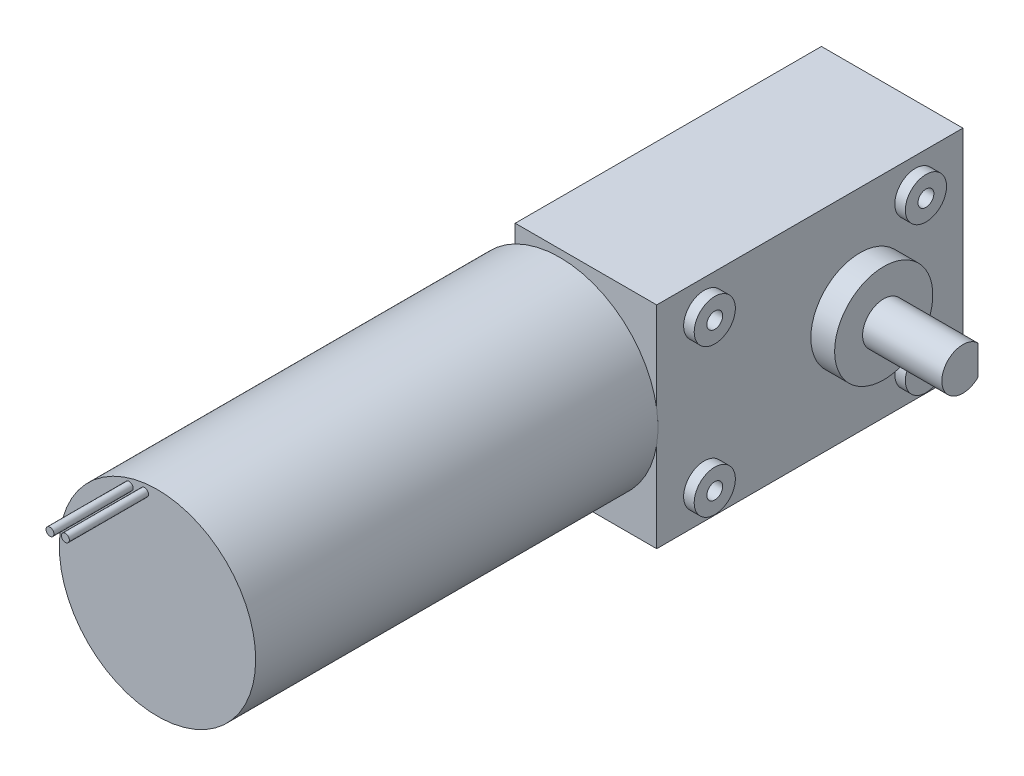
from build123d import *

# Parameters (mm, degrees)
SKETCH4_R            = 18.6
BOSS_EXTRUDE3_DEPTH  = 76.2
SKETCH5_R            = 0.75
BOSS_EXTRUDE4_DEPTH  = 15
SKETCH6_R            = 0.75
BOSS_EXTRUDE5_DEPTH  = 15
SKETCH7_W            = 26.8
SKETCH7_H            = 40
BOSS_EXTRUDE6_DEPTH  = 58
BOSS_EXTRUDE10_DEPTH = 1.8
BOSS_EXTRUDE11_DEPTH = 4.5
CUT_EXTRUDE1_START   = -3.5
CUT_EXTRUDE1_DEPTH   = 5.3
BOSS_EXTRUDE12_START = -28.8
BOSS_EXTRUDE12_DEPTH = 2
CUT_EXTRUDE2_START   = -28.8
CUT_EXTRUDE2_DEPTH   = 5.3
BOSS_EXTRUDE13_START = -31.3
BOSS_EXTRUDE13_DEPTH = 4.5
BOSS_EXTRUDE14_DEPTH = 15


with BuildPart() as part:
    # Sketch4 → Boss-Extrude3 (new body)
    with BuildSketch(Plane.XY):
        with Locations(Location((-63.856856352, 21.865677116, 0), (0, 0, 180))):
            Circle(SKETCH4_R)
    extrude(amount=BOSS_EXTRUDE3_DEPTH)

    # Sketch5 → Boss-Extrude4 (add)
    with BuildSketch(Plane.XY.offset(76.2)):
        with Locations((-66.305296551, 38.820097555)):
            Circle(SKETCH5_R)
    extrude(amount=BOSS_EXTRUDE4_DEPTH)

    # Sketch6 → Boss-Extrude5 (add)
    with BuildSketch(Plane.XY.offset(76.2)):
        with Locations((-69.224873833, 38.364991381)):
            Circle(SKETCH6_R)
    extrude(amount=BOSS_EXTRUDE5_DEPTH)

    # Sketch7 → Boss-Extrude6 (add)
    with BuildSketch(Plane(origin=(0, 0, 0), x_dir=(-1, 0, 0), z_dir=(0, 0, -1))):
        with Locations((58.895304338, 21.83595021)):
            Rectangle(SKETCH7_W, SKETCH7_H)
    extrude(amount=BOSS_EXTRUDE6_DEPTH)

    # Sketch22 → Boss-Extrude10 (add)
    with BuildSketch(Plane.ZY.offset(72.295304338)):
        with BuildLine():
            ThreePointArc((-29.2, 21.83595021), (-38.5, 31.13595021), (-47.8, 21.83595021))
            Line((-47.8, 21.83595021), (-29.2, 21.83595021))
        make_face()
        with BuildLine():
            Line((-29.2, 21.83595021), (-47.8, 21.83595021))
            ThreePointArc((-47.8, 21.83595021), (-38.5, 12.53595021), (-29.2, 21.83595021))
        make_face()
        with BuildLine():
            ThreePointArc((-45.1, 7.83595021), (-46.242283553, 10.593666656), (-49, 11.73595021))
            Line((-49, 11.73595021), (-49, 9.33595021))
            ThreePointArc((-49, 9.33595021), (-47.939339828, 8.896610381), (-47.5, 7.83595021))
            Line((-47.5, 7.83595021), (-45.1, 7.83595021))
        make_face()
        with BuildLine():
            Line((-49, 9.33595021), (-49, 11.73595021))
            ThreePointArc((-49, 11.73595021), (-51.757716447, 5.078233763), (-45.1, 7.83595021))
            Line((-45.1, 7.83595021), (-47.5, 7.83595021))
            ThreePointArc((-47.5, 7.83595021), (-50.060660172, 6.775290038), (-49, 9.33595021))
        make_face()
        with BuildLine():
            ThreePointArc((-49, 34.33595021), (-50.060660172, 36.896610381), (-47.5, 35.83595021))
            Line((-47.5, 35.83595021), (-45.1, 35.83595021))
            ThreePointArc((-45.1, 35.83595021), (-51.757716447, 38.593666656), (-49, 31.93595021))
            Line((-49, 31.93595021), (-49, 34.33595021))
        make_face()
        with BuildLine():
            Line((-45.1, 35.83595021), (-47.5, 35.83595021))
            ThreePointArc((-47.5, 35.83595021), (-47.939339828, 34.775290038), (-49, 34.33595021))
            Line((-49, 34.33595021), (-49, 31.93595021))
            ThreePointArc((-49, 31.93595021), (-46.242283553, 33.078233763), (-45.1, 35.83595021))
        make_face()
        with BuildLine():
            ThreePointArc((-5.1, 35.83595021), (-9, 39.73595021), (-12.9, 35.83595021))
            Line((-12.9, 35.83595021), (-10.5, 35.83595021))
            ThreePointArc((-10.5, 35.83595021), (-9, 37.33595021), (-7.5, 35.83595021))
            ThreePointArc((-7.5, 35.83595021), (-7.939339828, 34.775290038), (-9, 34.33595021))
            Line((-9, 34.33595021), (-9, 31.93595021))
            ThreePointArc((-9, 31.93595021), (-6.242283553, 33.078233763), (-5.1, 35.83595021))
        make_face()
        with BuildLine():
            Line((-10.5, 35.83595021), (-12.9, 35.83595021))
            ThreePointArc((-12.9, 35.83595021), (-11.757716447, 33.078233763), (-9, 31.93595021))
            Line((-9, 31.93595021), (-9, 34.33595021))
            ThreePointArc((-9, 34.33595021), (-10.060660172, 34.775290038), (-10.5, 35.83595021))
        make_face()
        with BuildLine():
            ThreePointArc((-5.1, 7.83595021), (-6.242283553, 10.593666656), (-9, 11.73595021))
            Line((-9, 11.73595021), (-9, 9.33595021))
            ThreePointArc((-9, 9.33595021), (-7.939339828, 8.896610381), (-7.5, 7.83595021))
            ThreePointArc((-7.5, 7.83595021), (-9, 6.33595021), (-10.5, 7.83595021))
            Line((-10.5, 7.83595021), (-12.9, 7.83595021))
            ThreePointArc((-12.9, 7.83595021), (-9, 3.93595021), (-5.1, 7.83595021))
        make_face()
        with BuildLine():
            Line((-9, 9.33595021), (-9, 11.73595021))
            ThreePointArc((-9, 11.73595021), (-11.757716447, 10.593666656), (-12.9, 7.83595021))
            Line((-12.9, 7.83595021), (-10.5, 7.83595021))
            ThreePointArc((-10.5, 7.83595021), (-10.060660172, 8.896610381), (-9, 9.33595021))
        make_face()
    extrude(amount=BOSS_EXTRUDE10_DEPTH)

    # Sketch22<4> → Boss-Extrude11 (add)
    with BuildSketch(Plane.ZY.offset(72.295304338)):
        with BuildLine():
            ThreePointArc((-29.2, 21.83595021), (-38.5, 31.13595021), (-47.8, 21.83595021))
            Line((-47.8, 21.83595021), (-29.2, 21.83595021))
        make_face()
        with BuildLine():
            Line((-29.2, 21.83595021), (-47.8, 21.83595021))
            ThreePointArc((-47.8, 21.83595021), (-38.5, 12.53595021), (-29.2, 21.83595021))
        make_face()
    extrude(amount=BOSS_EXTRUDE11_DEPTH)

    # Sketch22<5> → Cut-Extrude1 (cut)
    with BuildSketch(Plane.ZY.offset(72.295304338).offset(CUT_EXTRUDE1_START)):
        with BuildLine():
            ThreePointArc((-47.5, 7.83595021), (-47.939339828, 8.896610381), (-49, 9.33595021))
            Line((-49, 9.33595021), (-49, 7.83595021))
            Line((-49, 7.83595021), (-47.5, 7.83595021))
        make_face()
        with BuildLine():
            Line((-49, 7.83595021), (-49, 9.33595021))
            ThreePointArc((-49, 9.33595021), (-50.060660172, 6.775290038), (-47.5, 7.83595021))
            Line((-47.5, 7.83595021), (-49, 7.83595021))
        make_face()
        with BuildLine():
            Line((-49, 34.33595021), (-49, 35.83595021))
            Line((-49, 35.83595021), (-47.5, 35.83595021))
            ThreePointArc((-47.5, 35.83595021), (-50.060660172, 36.896610381), (-49, 34.33595021))
        make_face()
        with BuildLine():
            Line((-47.5, 35.83595021), (-49, 35.83595021))
            Line((-49, 35.83595021), (-49, 34.33595021))
            ThreePointArc((-49, 34.33595021), (-47.939339828, 34.775290038), (-47.5, 35.83595021))
        make_face()
        with BuildLine():
            ThreePointArc((-7.5, 35.83595021), (-9, 37.33595021), (-10.5, 35.83595021))
            Line((-10.5, 35.83595021), (-9, 35.83595021))
            Line((-9, 35.83595021), (-9, 34.33595021))
            ThreePointArc((-9, 34.33595021), (-7.939339828, 34.775290038), (-7.5, 35.83595021))
        make_face()
        with BuildLine():
            Line((-9, 35.83595021), (-10.5, 35.83595021))
            ThreePointArc((-10.5, 35.83595021), (-10.060660172, 34.775290038), (-9, 34.33595021))
            Line((-9, 34.33595021), (-9, 35.83595021))
        make_face()
        with BuildLine():
            ThreePointArc((-7.5, 7.83595021), (-7.939339828, 8.896610381), (-9, 9.33595021))
            Line((-9, 9.33595021), (-9, 7.83595021))
            Line((-9, 7.83595021), (-10.5, 7.83595021))
            ThreePointArc((-10.5, 7.83595021), (-9, 6.33595021), (-7.5, 7.83595021))
        make_face()
        with BuildLine():
            Line((-9, 7.83595021), (-9, 9.33595021))
            ThreePointArc((-9, 9.33595021), (-10.060660172, 8.896610381), (-10.5, 7.83595021))
            Line((-10.5, 7.83595021), (-9, 7.83595021))
        make_face()
    extrude(amount=CUT_EXTRUDE1_DEPTH, mode=Mode.SUBTRACT)

    # Sketch22<6> → Boss-Extrude12 (add)
    with BuildSketch(Plane.ZY.offset(72.295304338).offset(BOSS_EXTRUDE12_START)):
        with BuildLine():
            ThreePointArc((-5.1, 35.83595021), (-9, 39.73595021), (-12.9, 35.83595021))
            Line((-12.9, 35.83595021), (-10.5, 35.83595021))
            ThreePointArc((-10.5, 35.83595021), (-9, 37.33595021), (-7.5, 35.83595021))
            ThreePointArc((-7.5, 35.83595021), (-7.939339828, 34.775290038), (-9, 34.33595021))
            Line((-9, 34.33595021), (-9, 31.93595021))
            ThreePointArc((-9, 31.93595021), (-6.242283553, 33.078233763), (-5.1, 35.83595021))
        make_face()
        with BuildLine():
            Line((-10.5, 35.83595021), (-12.9, 35.83595021))
            ThreePointArc((-12.9, 35.83595021), (-11.757716447, 33.078233763), (-9, 31.93595021))
            Line((-9, 31.93595021), (-9, 34.33595021))
            ThreePointArc((-9, 34.33595021), (-10.060660172, 34.775290038), (-10.5, 35.83595021))
        make_face()
        with BuildLine():
            ThreePointArc((-5.1, 7.83595021), (-6.242283553, 10.593666656), (-9, 11.73595021))
            Line((-9, 11.73595021), (-9, 9.33595021))
            ThreePointArc((-9, 9.33595021), (-7.939339828, 8.896610381), (-7.5, 7.83595021))
            ThreePointArc((-7.5, 7.83595021), (-9, 6.33595021), (-10.5, 7.83595021))
            Line((-10.5, 7.83595021), (-12.9, 7.83595021))
            ThreePointArc((-12.9, 7.83595021), (-9, 3.93595021), (-5.1, 7.83595021))
        make_face()
        with BuildLine():
            Line((-9, 9.33595021), (-9, 11.73595021))
            ThreePointArc((-9, 11.73595021), (-11.757716447, 10.593666656), (-12.9, 7.83595021))
            Line((-12.9, 7.83595021), (-10.5, 7.83595021))
            ThreePointArc((-10.5, 7.83595021), (-10.060660172, 8.896610381), (-9, 9.33595021))
        make_face()
        with BuildLine():
            ThreePointArc((-49, 34.33595021), (-50.060660172, 36.896610381), (-47.5, 35.83595021))
            Line((-47.5, 35.83595021), (-45.1, 35.83595021))
            ThreePointArc((-45.1, 35.83595021), (-51.757716447, 38.593666656), (-49, 31.93595021))
            Line((-49, 31.93595021), (-49, 34.33595021))
        make_face()
        with BuildLine():
            Line((-45.1, 35.83595021), (-47.5, 35.83595021))
            ThreePointArc((-47.5, 35.83595021), (-47.939339828, 34.775290038), (-49, 34.33595021))
            Line((-49, 34.33595021), (-49, 31.93595021))
            ThreePointArc((-49, 31.93595021), (-46.242283553, 33.078233763), (-45.1, 35.83595021))
        make_face()
        with BuildLine():
            ThreePointArc((-45.1, 7.83595021), (-46.242283553, 10.593666656), (-49, 11.73595021))
            Line((-49, 11.73595021), (-49, 9.33595021))
            ThreePointArc((-49, 9.33595021), (-47.939339828, 8.896610381), (-47.5, 7.83595021))
            Line((-47.5, 7.83595021), (-45.1, 7.83595021))
        make_face()
        with BuildLine():
            Line((-49, 9.33595021), (-49, 11.73595021))
            ThreePointArc((-49, 11.73595021), (-51.757716447, 5.078233763), (-45.1, 7.83595021))
            Line((-45.1, 7.83595021), (-47.5, 7.83595021))
            ThreePointArc((-47.5, 7.83595021), (-50.060660172, 6.775290038), (-49, 9.33595021))
        make_face()
    extrude(amount=BOSS_EXTRUDE12_DEPTH)

    # Sketch22<7> → Cut-Extrude2 (cut)
    with BuildSketch(Plane.ZY.offset(72.295304338).offset(CUT_EXTRUDE2_START)):
        with BuildLine():
            ThreePointArc((-7.5, 7.83595021), (-7.939339828, 8.896610381), (-9, 9.33595021))
            Line((-9, 9.33595021), (-9, 7.83595021))
            Line((-9, 7.83595021), (-10.5, 7.83595021))
            ThreePointArc((-10.5, 7.83595021), (-9, 6.33595021), (-7.5, 7.83595021))
        make_face()
        with BuildLine():
            Line((-9, 7.83595021), (-9, 9.33595021))
            ThreePointArc((-9, 9.33595021), (-10.060660172, 8.896610381), (-10.5, 7.83595021))
            Line((-10.5, 7.83595021), (-9, 7.83595021))
        make_face()
        with BuildLine():
            ThreePointArc((-7.5, 35.83595021), (-9, 37.33595021), (-10.5, 35.83595021))
            Line((-10.5, 35.83595021), (-9, 35.83595021))
            Line((-9, 35.83595021), (-9, 34.33595021))
            ThreePointArc((-9, 34.33595021), (-7.939339828, 34.775290038), (-7.5, 35.83595021))
        make_face()
        with BuildLine():
            Line((-9, 35.83595021), (-10.5, 35.83595021))
            ThreePointArc((-10.5, 35.83595021), (-10.060660172, 34.775290038), (-9, 34.33595021))
            Line((-9, 34.33595021), (-9, 35.83595021))
        make_face()
        with BuildLine():
            Line((-49, 34.33595021), (-49, 35.83595021))
            Line((-49, 35.83595021), (-47.5, 35.83595021))
            ThreePointArc((-47.5, 35.83595021), (-50.060660172, 36.896610381), (-49, 34.33595021))
        make_face()
        with BuildLine():
            Line((-47.5, 35.83595021), (-49, 35.83595021))
            Line((-49, 35.83595021), (-49, 34.33595021))
            ThreePointArc((-49, 34.33595021), (-47.939339828, 34.775290038), (-47.5, 35.83595021))
        make_face()
        with BuildLine():
            ThreePointArc((-47.5, 7.83595021), (-47.939339828, 8.896610381), (-49, 9.33595021))
            Line((-49, 9.33595021), (-49, 7.83595021))
            Line((-49, 7.83595021), (-47.5, 7.83595021))
        make_face()
        with BuildLine():
            Line((-49, 7.83595021), (-49, 9.33595021))
            ThreePointArc((-49, 9.33595021), (-50.060660172, 6.775290038), (-47.5, 7.83595021))
            Line((-47.5, 7.83595021), (-49, 7.83595021))
        make_face()
    extrude(amount=CUT_EXTRUDE2_DEPTH, mode=Mode.SUBTRACT)

    # Sketch22<8> → Boss-Extrude13 (add)
    with BuildSketch(Plane.ZY.offset(72.295304338).offset(BOSS_EXTRUDE13_START)):
        with BuildLine():
            ThreePointArc((-29.2, 21.83595021), (-38.5, 31.13595021), (-47.8, 21.83595021))
            Line((-47.8, 21.83595021), (-29.2, 21.83595021))
        make_face()
        with BuildLine():
            Line((-29.2, 21.83595021), (-47.8, 21.83595021))
            ThreePointArc((-47.8, 21.83595021), (-38.5, 12.53595021), (-29.2, 21.83595021))
        make_face()
    extrude(amount=BOSS_EXTRUDE13_DEPTH)

    # Sketch21 → Boss-Extrude14 (add)
    with BuildSketch(Plane(origin=(-40.995304338, 0, 0), x_dir=(0, 0, -1), z_dir=(1, 0, 0))):
        with BuildLine():
            Line((41.36, 19.0394524), (41.36, 24.632448019))
            ThreePointArc((41.36, 24.632448019), (34.5, 21.83595021), (41.36, 19.0394524))
        make_face()
    extrude(amount=BOSS_EXTRUDE14_DEPTH)


solid = part.part
